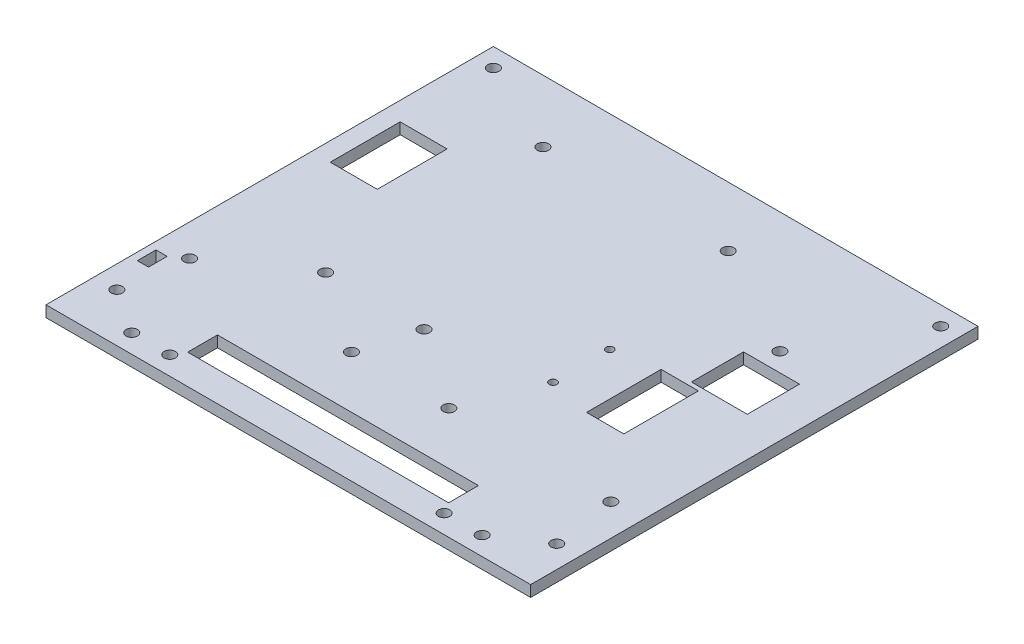
from build123d import *

# Parameters (mm, degrees)
SKETCH1_R           = 1.525
SKETCH1_R_2         = 1.025
SKETCH1_W           = 70
SKETCH1_H           = 8
SKETCH1_W_2         = 3
SKETCH1_H_2         = 5
SKETCH1_W_3         = 10
SKETCH1_H_3         = 20
SKETCH1_W_4         = 15
SKETCH1_H_4         = 14
SKETCH1_W_5         = 12.6
SKETCH1_H_5         = 18.75
BOSS_EXTRUDE1_DEPTH = 3


with BuildPart() as part:
    # Sketch1 → Boss-Extrude1 (new body)
    with BuildSketch(Plane(origin=(0, 0, 0), x_dir=(1, 0, 0), z_dir=(0, 1, 0))):
        Polygon((0, 0), (130, 0), (130, -92.5), (130, -97.5), (130, -120), (0, -120), (0, -97.5), (0, -92.5), align=None)
        with Locations(Location((28.2, -115, 0), (0, 0, 270))):
            Circle(SKETCH1_R, mode=Mode.SUBTRACT)
        with Locations(Location((101.8, -115, 0), (0, 0, 270))):
            Circle(SKETCH1_R, mode=Mode.SUBTRACT)
        with Locations(Location((121.5, -90, 0), (0, 0, 270))):
            Circle(SKETCH1_R, mode=Mode.SUBTRACT)
        with Locations(Location((8.5, -90, 0), (0, 0, 270))):
            Circle(SKETCH1_R, mode=Mode.SUBTRACT)
        with Locations(Location((78.06, -90, 0), (0, 0, 270))):
            Circle(SKETCH1_R, mode=Mode.SUBTRACT)
        with Locations(Location((51.94, -90, 0), (0, 0, 270))):
            Circle(SKETCH1_R, mode=Mode.SUBTRACT)
        with Locations(Location((124, -107, 0), (0, 0, 270))):
            Circle(SKETCH1_R, mode=Mode.SUBTRACT)
        with Locations(Location((6, -107, 0), (0, 0, 270))):
            Circle(SKETCH1_R, mode=Mode.SUBTRACT)
        with Locations(Location((30, -75, 0), (0, 0, 270))):
            Circle(SKETCH1_R, mode=Mode.SUBTRACT)
        with Locations(Location((30, -16.71, 0), (0, 0, 270))):
            Circle(SKETCH1_R, mode=Mode.SUBTRACT)
        with Locations(Location((56.4, -75, 0), (0, 0, 270))):
            Circle(SKETCH1_R, mode=Mode.SUBTRACT)
        with Locations(Location((86, -70, 0), (0, 0, 270))):
            Circle(SKETCH1_R_2, mode=Mode.SUBTRACT)
        with Locations(Location((86, -54.77, 0), (0, 0, 270))):
            Circle(SKETCH1_R_2, mode=Mode.SUBTRACT)
        with Locations(Location((79, -16, 0), (0, 0, 270))):
            Circle(SKETCH1_R, mode=Mode.SUBTRACT)
        with Locations(Location((109.24, -32.38, 0), (0, 0, 270))):
            Circle(SKETCH1_R, mode=Mode.SUBTRACT)
        with Locations(Location((18, -115, 0), (0, 0, 270))):
            Circle(SKETCH1_R, mode=Mode.SUBTRACT)
        with Locations(Location((112, -115, 0), (0, 0, 270))):
            Circle(SKETCH1_R, mode=Mode.SUBTRACT)
        with Locations(Location((5, -5, 0), (0, 0, 270))):
            Circle(SKETCH1_R, mode=Mode.SUBTRACT)
        with Locations(Location((125, -5, 0), (0, 0, 270))):
            Circle(SKETCH1_R, mode=Mode.SUBTRACT)
        with Locations((65, -108)):
            Rectangle(SKETCH1_W, SKETCH1_H, mode=Mode.SUBTRACT)
        with Locations((3.5, -95)):
            Rectangle(SKETCH1_W_2, SKETCH1_H_2, mode=Mode.SUBTRACT)
        with Locations((102.5, -62.5)):
            Rectangle(SKETCH1_W_3, SKETCH1_H_3, mode=Mode.SUBTRACT)
        with Locations((112, -44.38)):
            Rectangle(SKETCH1_W_4, SKETCH1_H_4, mode=Mode.SUBTRACT)
        with Locations((11.3, -39.375)):
            Rectangle(SKETCH1_W_5, SKETCH1_H_5, mode=Mode.SUBTRACT)
    extrude(amount=BOSS_EXTRUDE1_DEPTH)


solid = part.part
